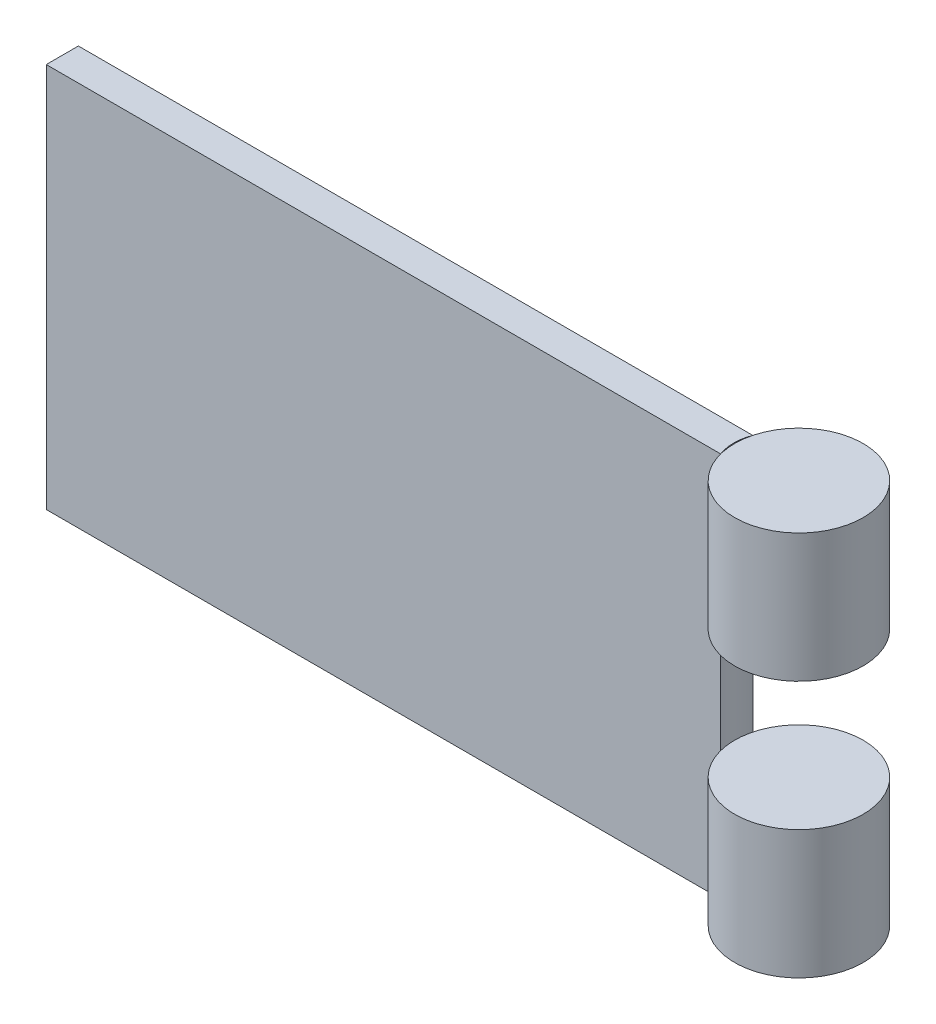
from build123d import *

# Parameters (mm, degrees)
SKETCH1_W               = 120
SKETCH1_H               = 60
BOSS_EXTRUDE4_DEPTH     = 5
CUT_EXTRUDE3_DEPTH      = 150.441021831
CUT_EXTRUDE3_DEPTH_BACK = 60
SKETCH18_R              = 10
BOSS_EXTRUDE9_DEPTH     = 20
SKETCH19_R              = 10
BOSS_EXTRUDE10_DEPTH    = 20
SKETCH20_W              = 15
SKETCH20_H              = 60
CUT_EXTRUDE4_DEPTH      = 10


with BuildPart() as part:
    # Sketch1 → Boss-Extrude4 (new body)
    with BuildSketch(Plane.XY):
        with Locations((-76.775798319, -59.134789916)):
            Rectangle(SKETCH1_W, SKETCH1_H)
    extrude(amount=BOSS_EXTRUDE4_DEPTH)

    # Sketch6 → Cut-Extrude3 (cut, two sides: drawn at the far end of the back side and taken through both)
    with BuildSketch(Plane(origin=(0, -29.134789916, 0), x_dir=(1, 0, 0), z_dir=(0, 1, 0)).offset(-CUT_EXTRUDE3_DEPTH_BACK)):
        with BuildLine():
            Line((72.584288463, 233.706952721), (-16.775798319, 0))
            ThreePointArc((-16.775798319, 0), (-17.237449904, -2.5), (-16.775798319, -5))
            Line((-16.775798319, -5), (72.584288463, -238.706952721))
            Line((72.584288463, -238.706952721), (573.000774441, -238.706952721))
            Line((573.000774441, -238.706952721), (573.000774441, 233.706952721))
            Line((573.000774441, 233.706952721), (72.584288463, 233.706952721))
        make_face()
    extrude(amount=CUT_EXTRUDE3_DEPTH + CUT_EXTRUDE3_DEPTH_BACK, mode=Mode.SUBTRACT)

    # Sketch20 → Cut-Extrude4 (cut)
    with BuildSketch(Plane(origin=(0, 0, 0), x_dir=(-1, 0, 0), z_dir=(0, 0, -1))):
        with Locations((129.275798319, -59.134789916)):
            Rectangle(SKETCH20_W, SKETCH20_H)
    extrude(amount=-CUT_EXTRUDE4_DEPTH, mode=Mode.SUBTRACT)


with BuildPart() as body_2:
    # Sketch18 → Boss-Extrude9 (new body)
    with BuildSketch(Plane(origin=(0, -29.134789916, 0), x_dir=(1, 0, 0), z_dir=(0, 1, 0))):
        with Locations(Location((-7.093339954, -2.5, 0), (0, 0, 270))):
            Circle(SKETCH18_R)
    extrude(amount=-BOSS_EXTRUDE9_DEPTH)


with BuildPart() as body_3:
    # Sketch19 → Boss-Extrude10 (new body)
    with BuildSketch(Plane.XZ.offset(89.134789916)):
        with Locations(Location((-7.093339954, 2.5, 0), (0, 0, 270))):
            Circle(SKETCH19_R)
    extrude(amount=-BOSS_EXTRUDE10_DEPTH)


solid = Compound([part.part, body_2.part, body_3.part])
